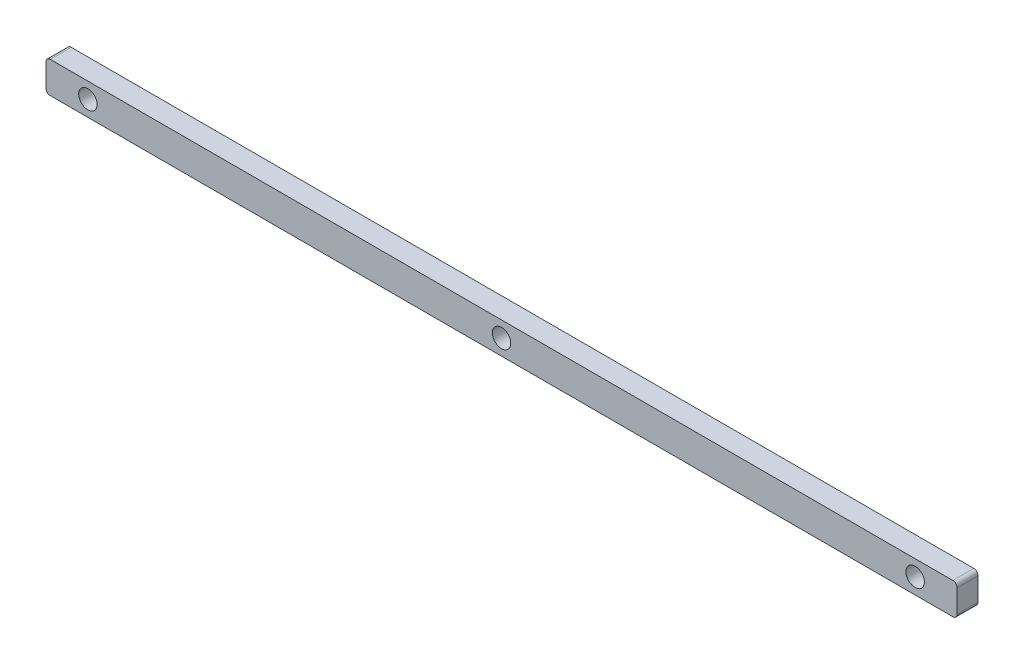
from build123d import *

# Parameters (mm, degrees)
SKETCH1_W           = 552.45
SKETCH1_H           = 19.05
SKETCH1_R           = 5.588
BOSS_EXTRUDE1_DEPTH = 6.35
FILLET1_R           = 2.54


with BuildPart() as part:
    # Sketch1 → Boss-Extrude1 (new, symmetric)
    with BuildSketch(Plane.XY):
        Rectangle(SKETCH1_W, SKETCH1_H)
        Circle(SKETCH1_R, mode=Mode.SUBTRACT)
        with Locations((-250.825, 0)):
            Circle(SKETCH1_R, mode=Mode.SUBTRACT)
        with Locations((250.825, 0)):
            Circle(SKETCH1_R, mode=Mode.SUBTRACT)
    extrude(amount=BOSS_EXTRUDE1_DEPTH, both=True)

    # Fillet1
    fillet1_edges = [part.edges().sort_by_distance(p)[0] for p in [
        (276.225, -9.525, 0),
        (-276.225, -9.525, 0),
        (-276.225, 9.525, 0),
        (276.225, 9.525, 0),
    ]]
    fillet(fillet1_edges, radius=FILLET1_R)


solid = part.part
